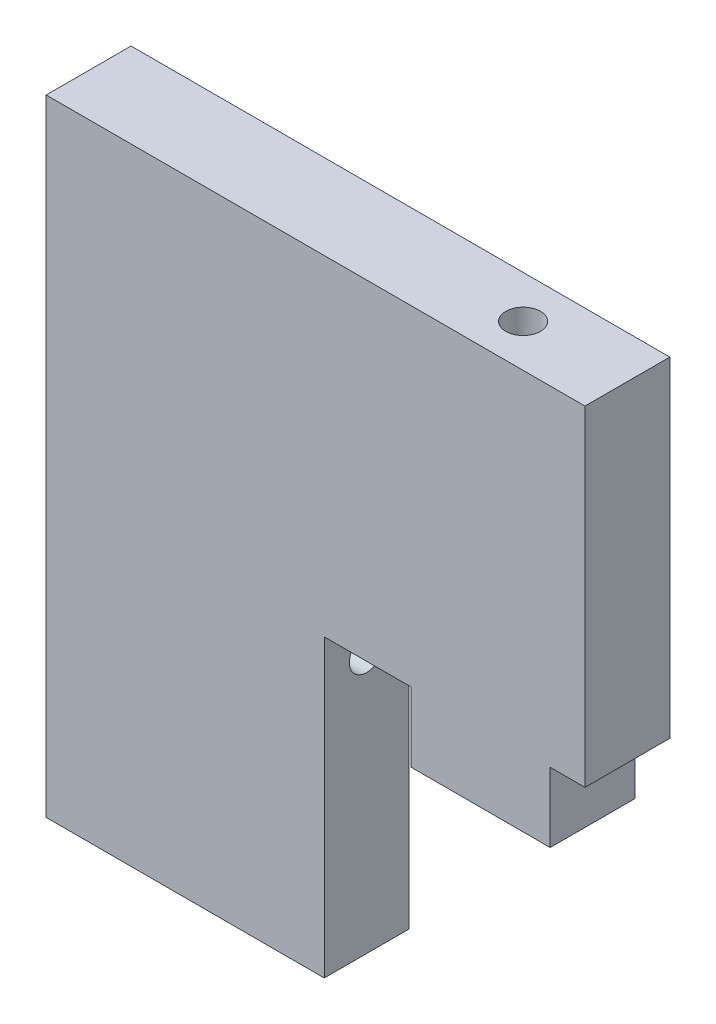
from build123d import *

# Parameters (mm, degrees)
BOSS_EXTRUDE3_DEPTH     = 31
SKETCH2_R               = 12.7
CUT_EXTRUDE1_DEPTH      = 317.5
CUT_EXTRUDE3_DEPTH      = 416.807816184
CUT_EXTRUDE3_DEPTH_BACK = 416.807816184
SKETCH6_R               = 12.7
SKETCH3_R               = 19.05
CUT_EXTRUDE4_DEPTH      = 15.24
SKETCH7_R               = 5
CUT_EXTRUDE5_DEPTH      = 25.4


with BuildPart() as part:
    # Sketch5 → Boss-Extrude3 (new, symmetric)
    with BuildSketch(Plane.XY):
        Polygon((76.2, 266.7), (-317.5, 266.7), (-317.5, -190.5), (-114.3, -190.5), (-114.3, 25.4), (-50.8, 25.4), (-50.8, -25.4), (50.8, -25.4), (50.8, 25.4), (76.2, 25.4), align=None)
    extrude(amount=BOSS_EXTRUDE3_DEPTH, both=True)

    # Sketch2 → Cut-Extrude1 (cut)
    with BuildSketch(Plane(origin=(-317.5, 0, -457.2), x_dir=(0, 0, -1), z_dir=(1, 0, 0))):
        with Locations(Location((-457.2, 0, 0), (0, 0, 90))):
            Circle(SKETCH2_R)
    extrude(amount=CUT_EXTRUDE1_DEPTH, mode=Mode.SUBTRACT)

    # Sketch6 → Cut-Extrude3 (cut, two sides: drawn at the far end of the back side and taken through both)
    with BuildSketch(Plane(origin=(0, 0, 0), x_dir=(1, 0, 0), z_dir=(0, 1, 0)).offset(-CUT_EXTRUDE3_DEPTH_BACK)):
        with Locations(Location((0, 0, 0), (0, 0, 270))):
            Circle(SKETCH6_R)
    extrude(amount=CUT_EXTRUDE3_DEPTH + CUT_EXTRUDE3_DEPTH_BACK, mode=Mode.SUBTRACT)

    # Sketch3 → Cut-Extrude4 (cut)
    with BuildSketch(Plane(origin=(-317.5, 0, -457.2), x_dir=(0, 0, -1), z_dir=(1, 0, 0))):
        with Locations(Location((-457.2, 0, 0), (0, 0, 180))):
            Circle(SKETCH3_R)
    extrude(amount=CUT_EXTRUDE4_DEPTH, mode=Mode.SUBTRACT)

    # Sketch7 → Cut-Extrude5 (cut)
    with BuildSketch(Plane.XZ.offset(190.5)):
        with Locations((-291.304206057, 21.825)):
            Circle(SKETCH7_R)
        with Locations((-291.304206057, -21.825)):
            Circle(SKETCH7_R)
        with Locations((-241.304206057, 21.825)):
            Circle(SKETCH7_R)
        with Locations((-241.304206057, -21.825)):
            Circle(SKETCH7_R)
        with Locations((-191.304206057, 21.825)):
            Circle(SKETCH7_R)
        with Locations((-191.304206057, -21.825)):
            Circle(SKETCH7_R)
    extrude(amount=-CUT_EXTRUDE5_DEPTH, mode=Mode.SUBTRACT)


solid = part.part
